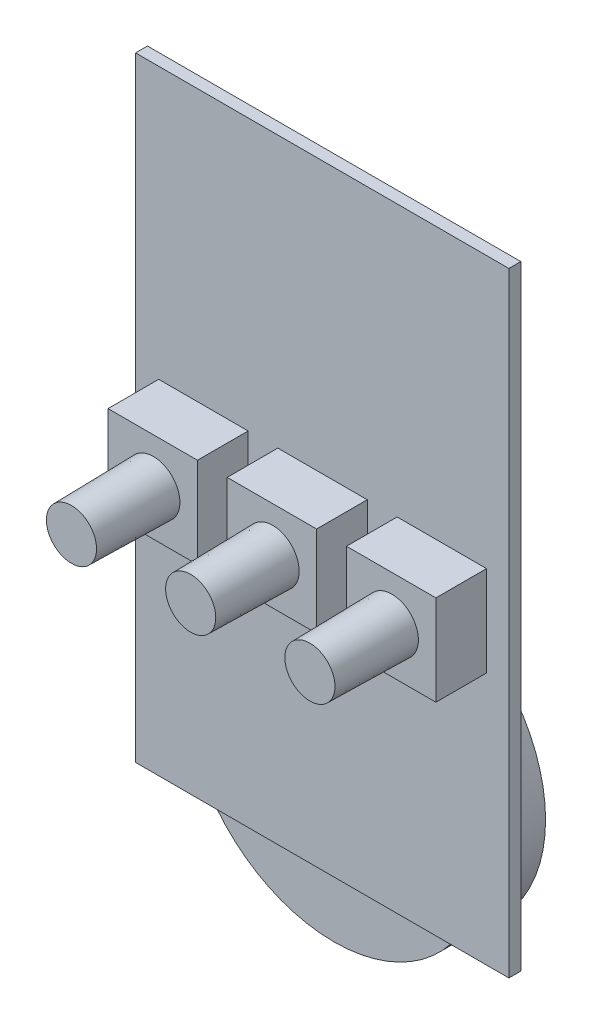
from build123d import *

# Parameters (mm, degrees)
SKETCH_20_W                   = 25.05
SKETCH_20_H                   = 41.23
BOSS_EXTRUDE1_DEPTH           = 0.8
SKETCH13_W                    = 6
SKETCH13_H                    = 6.063806384
BOSS_EXTRUDE2_DEPTH           = 3.4
SKETCH14_R                    = 1.778
BOSS_EXTRUDE3_DEPTH           = 5.5
BOSS_EXTRUDE3_DRAFT           = 1
BOSS_EXTRUDE3_PROFILE_2_DEPTH = 5.5
BOSS_EXTRUDE3_PROFILE_2_DRAFT = 1
BOSS_EXTRUDE3_PROFILE_3_DEPTH = 5.5
BOSS_EXTRUDE3_PROFILE_3_DRAFT = 1
SKETCH15_R                    = 10
BOSS_EXTRUDE4_DEPTH           = 4.2


with BuildPart() as part:
    # Sketch 20 → Boss-Extrude1 (new body)
    with BuildSketch(Plane.XY):
        with Locations((12.525, 20.615)):
            Rectangle(SKETCH_20_W, SKETCH_20_H)
    extrude(amount=-BOSS_EXTRUDE1_DEPTH)

    # Sketch13 → Boss-Extrude2 (add)
    with BuildSketch(Plane.XY):
        with Locations((4.55409918, 20.007058513)):
            Rectangle(SKETCH13_W, SKETCH13_H)
        with Locations((12.546384712, 20.007058513)):
            Rectangle(SKETCH13_W, SKETCH13_H)
        with Locations((20.551668538, 20.007058513)):
            Rectangle(SKETCH13_W, SKETCH13_H)
    extrude(amount=BOSS_EXTRUDE2_DEPTH)


with BuildPart() as boss_extrude3_tool:
    # Sketch14 → Boss-Extrude3 (with draft: the straight prism first)
    with BuildSketch(Plane.XY.offset(3.4)):
        with Locations((4.6, 20)):
            Circle(SKETCH14_R)
    extrude(amount=BOSS_EXTRUDE3_DEPTH)
    # Boss-Extrude3: the draft: its side faces are tilted about the plane it starts from
    boss_extrude3_sides = [boss_extrude3_tool.faces().sort_by_distance(p)[0] for p in [
        (2.822, 20, 6.15),
    ]]
    draft(boss_extrude3_sides, Plane.XY.offset(3.4), BOSS_EXTRUDE3_DRAFT)


with BuildPart() as part_1:
    add(part.part)

    # Boss-Extrude3: add boss_extrude3_tool
    add(boss_extrude3_tool.part)


with BuildPart() as boss_extrude3_profile_2_tool:
    # Sketch14 → Boss-Extrude3 profile 2 (with draft: the straight prism first)
    with BuildSketch(Plane.XY.offset(3.4)):
        with Locations((12.6, 20)):
            Circle(SKETCH14_R)
    extrude(amount=BOSS_EXTRUDE3_PROFILE_2_DEPTH)
    # Boss-Extrude3 profile 2: the draft: its side faces are tilted about the plane it starts from
    boss_extrude3_profile_2_sides = [boss_extrude3_profile_2_tool.faces().sort_by_distance(p)[0] for p in [
        (10.822, 20, 6.15),
    ]]
    draft(boss_extrude3_profile_2_sides, Plane.XY.offset(3.4), BOSS_EXTRUDE3_PROFILE_2_DRAFT)


with BuildPart() as part_2:
    add(part_1.part)

    # Boss-Extrude3 profile 2: add boss_extrude3_profile_2_tool
    add(boss_extrude3_profile_2_tool.part)


with BuildPart() as boss_extrude3_profile_3_tool:
    # Sketch14 → Boss-Extrude3 profile 3 (with draft: the straight prism first)
    with BuildSketch(Plane.XY.offset(3.4)):
        with Locations((20.6, 20)):
            Circle(SKETCH14_R)
    extrude(amount=BOSS_EXTRUDE3_PROFILE_3_DEPTH)
    # Boss-Extrude3 profile 3: the draft: its side faces are tilted about the plane it starts from
    boss_extrude3_profile_3_sides = [boss_extrude3_profile_3_tool.faces().sort_by_distance(p)[0] for p in [
        (18.822, 20, 6.15),
    ]]
    draft(boss_extrude3_profile_3_sides, Plane.XY.offset(3.4), BOSS_EXTRUDE3_PROFILE_3_DRAFT)


with BuildPart() as part_3:
    add(part_2.part)

    # Boss-Extrude3 profile 3: add boss_extrude3_profile_3_tool
    add(boss_extrude3_profile_3_tool.part)

    # Sketch15 → Boss-Extrude4 (add)
    with BuildSketch(Plane.XY.offset(-0.8)):
        with Locations((12.51, 5.43)):
            Circle(SKETCH15_R)
    extrude(amount=-BOSS_EXTRUDE4_DEPTH)


solid = part_3.part
